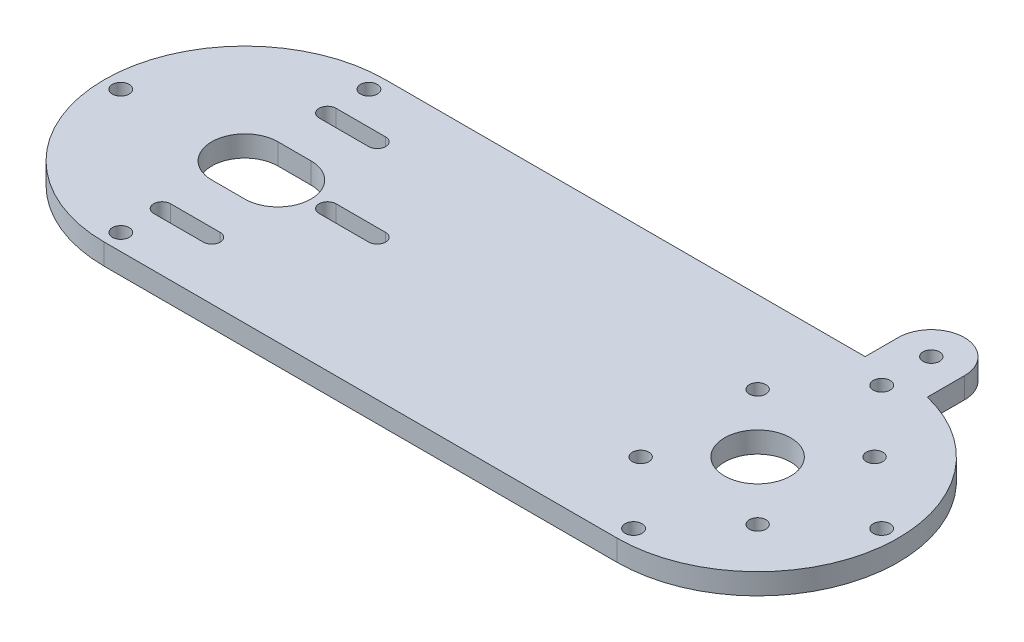
from build123d import *

# Parameters (mm, degrees)
SKETCH1_R           = 2.55
SKETCH1_R_2         = 2.5
SKETCH1_R_3         = 10
BOSS_EXTRUDE1_DEPTH = 6.35


with BuildPart() as part:
    # Sketch1 → Boss-Extrude1 (new body)
    with BuildSketch(Plane(origin=(0, 0, 0), x_dir=(1, 0, 0), z_dir=(0, 1, 0))):
        with BuildLine():
            ThreePointArc((-155, 42.5), (-197.5, 0), (-155, -42.5))
            Line((-155, -42.5), (0, -42.5))
            ThreePointArc((0, -42.5), (42.200640469, -5.0354686), (10, 41.306779105))
            Line((10, 41.306779105), (10, 52.5))
            ThreePointArc((10, 52.5), (0, 62.5), (-10, 52.5))
            Line((-10, 52.5), (-10, 42.5))
            Line((-10, 42.5), (-155, 42.5))
        make_face()
        with BuildLine():
            ThreePointArc((-115, 2.55), (-112.45, 0), (-115, -2.55))
            Line((-115, -2.55), (-130, -2.55))
            ThreePointArc((-130, -2.55), (-132.55, 0), (-130, 2.55))
            Line((-130, 2.55), (-115, 2.55))
        make_face(mode=Mode.SUBTRACT)
        with Locations(Location((-155, -37.5, 0), (0, 0, 270))):
            Circle(SKETCH1_R, mode=Mode.SUBTRACT)
        with BuildLine():
            ThreePointArc((-155, -27.55), (-157.55, -25), (-155, -22.45))
            Line((-155, -22.45), (-140, -22.45))
            ThreePointArc((-140, -22.45), (-137.45, -25), (-140, -27.55))
            Line((-140, -27.55), (-155, -27.55))
        make_face(mode=Mode.SUBTRACT)
        with Locations(Location((-192.5, 0, 0), (0, 0, 270))):
            Circle(SKETCH1_R, mode=Mode.SUBTRACT)
        with BuildLine():
            ThreePointArc((-155, -10), (-165, 0), (-155, 10))
            Line((-155, 10), (-145, 10))
            ThreePointArc((-145, 10), (-135, 0), (-145, -10))
            Line((-145, -10), (-155, -10))
        make_face(mode=Mode.SUBTRACT)
        with BuildLine():
            ThreePointArc((-155, 22.45), (-157.55, 25), (-155, 27.55))
            Line((-155, 27.55), (-140, 27.55))
            ThreePointArc((-140, 27.55), (-137.45, 25), (-140, 22.45))
            Line((-140, 22.45), (-155, 22.45))
        make_face(mode=Mode.SUBTRACT)
        with Locations(Location((-155, 37.5, 0), (0, 0, 270))):
            Circle(SKETCH1_R, mode=Mode.SUBTRACT)
        with Locations(Location((0, 37.5, 0), (0, 0, 270))):
            Circle(SKETCH1_R, mode=Mode.SUBTRACT)
        with Locations(Location((17.67766953, 17.67766953, 0), (0, 0, 270))):
            Circle(SKETCH1_R_2, mode=Mode.SUBTRACT)
        with Locations(Location((-17.67766953, -17.67766953, 0), (0, 0, 270))):
            Circle(SKETCH1_R_2, mode=Mode.SUBTRACT)
        with Locations(Location((0, -37.5, 0), (0, 0, 270))):
            Circle(SKETCH1_R, mode=Mode.SUBTRACT)
        with Locations(Location((17.67766953, -17.67766953, 0), (0, 0, 270))):
            Circle(SKETCH1_R_2, mode=Mode.SUBTRACT)
        with Locations(Location((0, 0, 0), (0, 0, 270))):
            Circle(SKETCH1_R_3, mode=Mode.SUBTRACT)
        with Locations(Location((37.5, 0, 0), (0, 0, 270))):
            Circle(SKETCH1_R, mode=Mode.SUBTRACT)
        with Locations(Location((-17.67766953, 17.67766953, 0), (0, 0, 270))):
            Circle(SKETCH1_R_2, mode=Mode.SUBTRACT)
        with Locations(Location((0, 52.5, 0), (0, 0, 270))):
            Circle(SKETCH1_R_2, mode=Mode.SUBTRACT)
    extrude(amount=-BOSS_EXTRUDE1_DEPTH)


solid = part.part
